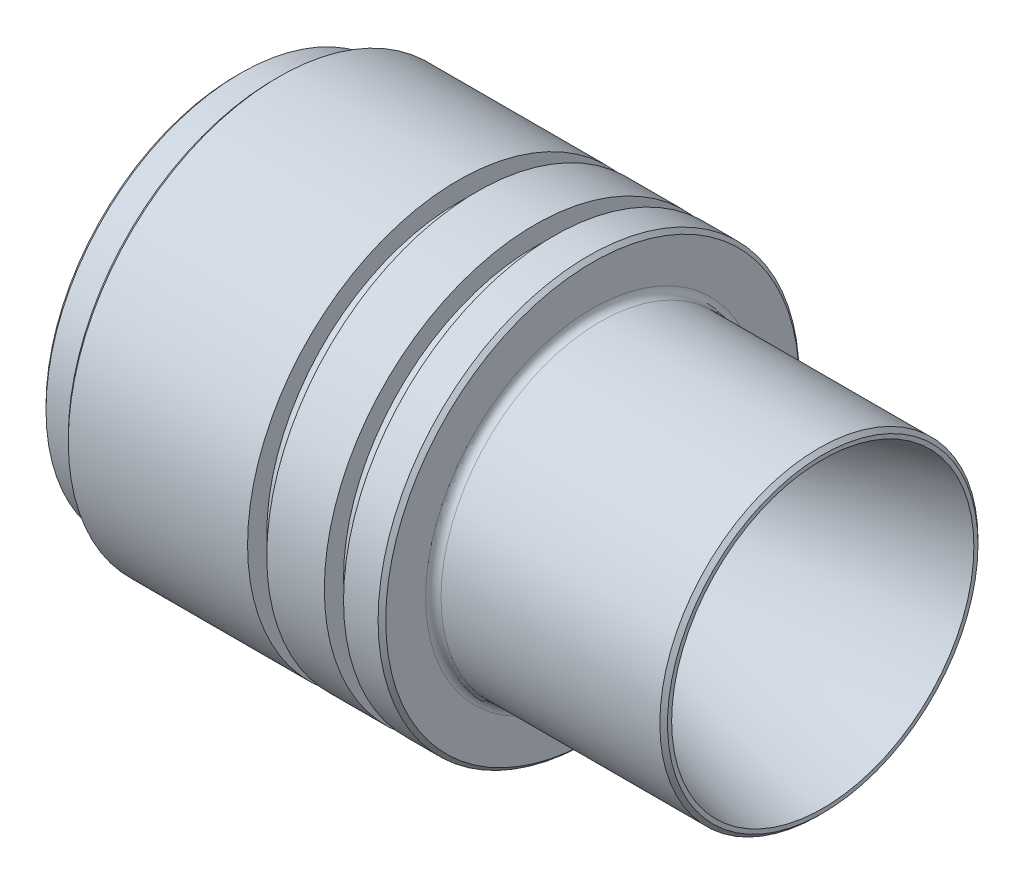
from build123d import *

# Parameters (mm, degrees)
CHAMFER1_SIZE = 0.635
FILLET1_R     = 1.27


with BuildPart() as part:
    # Sketch1 → Revolve1 (revolve)
    with BuildSketch(Plane.XY, mode=Mode.PRIVATE) as revolve1_sk:
        with BuildLine():
            Line((-31.75, 32.1564), (-38.1, 32.1564))
            Line((-38.1, 32.1564), (-38.1, 28.4734))
            Line((-38.1, 28.4734), (-28.86593235, 28.4734))
            ThreePointArc((-28.86593235, 28.4734), (-13.734767948, 24.672548379), (-2.19593235, 14.172363513))
            ThreePointArc((-2.19593235, 14.172363513), (2.380831725, 10.007569893), (8.382457197, 8.5))
            ThreePointArc((8.382457197, 8.5), (9.097140802, 8.578270584), (9.777942697, 8.809371687))
            add(Edge.make_bspline(
                [(58.868578041, 25), (34.22702979, 20.210168233), (9.777942697, 8.809371687)],
                knots=[0, 0, 0, 1, 1, 1], degree=2))
            Line((58.868578041, 25), (58.868578041, 26.3144))
            Line((58.868578041, 26.3144), (20.768578041, 26.3144))
            Line((20.768578041, 26.3144), (20.768578041, 34.8234))
            Line((20.768578041, 34.8234), (14.418578041, 34.8234))
            Line((14.418578041, 34.8234), (14.418578041, 31.6484))
            Line((14.418578041, 31.6484), (11.243578041, 31.6484))
            Line((11.243578041, 31.6484), (11.243578041, 34.8234))
            Line((11.243578041, 34.8234), (1.718578041, 34.8234))
            Line((1.718578041, 34.8234), (1.718578041, 31.6484))
            Line((1.718578041, 31.6484), (-1.456421959, 31.6484))
            Line((-1.456421959, 31.6484), (-1.456421959, 34.8234))
            Line((-1.456421959, 34.8234), (-31.75, 34.8234))
            Line((-31.75, 34.8234), (-31.75, 32.1564))
        make_face()
    revolve(revolve1_sk.sketch.rotate(Axis((-88.99, 0, 0), (1, 0, 0)), 90), axis=Axis((-88.99, 0, 0), (1, 0, 0)))

    # Chamfer1
    chamfer1_edges = [part.edges().sort_by_distance(p)[0] for p in [
        (-38.1, 0, -32.1564),
        (-31.75, 0, -34.8234),
        (20.768578041, 0, -34.8234),
        (58.868578041, 0, -26.3144),
    ]]
    chamfer(chamfer1_edges, length=CHAMFER1_SIZE)

    # Fillet1
    fillet1_edges = [part.edges().sort_by_distance(p)[0] for p in [
        (20.768578041, 0, -26.3144),
    ]]
    fillet(fillet1_edges, radius=FILLET1_R)


solid = part.part
